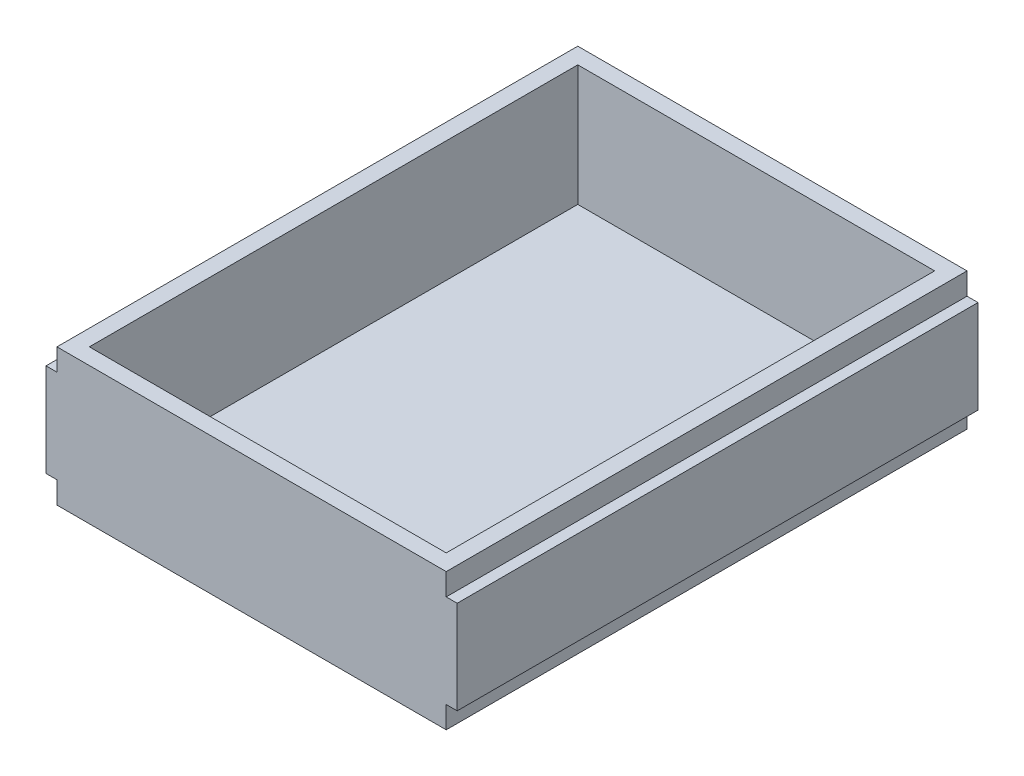
from build123d import *

# Parameters (mm, degrees)
CROQUIS1_W              = 72.136
CROQUIS1_H              = 25.4
SALIENTE_EXTRUIR1_DEPTH = 96.52
VACIADO1_T              = -3
CROQUIS2_W              = 2.032
CROQUIS2_H              = 17.272
SALIENTE_EXTRUIR3_DEPTH = 96.52
CROQUIS4_W              = 16.5
CROQUIS4_H              = 4
SALIENTE_EXTRUIR4_DEPTH = 4.5


with BuildPart() as part:
    # Croquis1 → Saliente-Extruir1 (new body)
    with BuildSketch(Plane.XY):
        with Locations((-36.068, 12.7)):
            Rectangle(CROQUIS1_W, CROQUIS1_H)
    extrude(amount=SALIENTE_EXTRUIR1_DEPTH)

    # Vaciado1
    vaciado1_openings = [part.faces().sort_by_distance(p)[0] for p in [
        (-36.068, 25.4, 48.26),
    ]]
    offset(amount=VACIADO1_T, openings=vaciado1_openings, kind=Kind.INTERSECTION)

    # Croquis2 → Saliente-Extruir3 (add)
    with BuildSketch(Plane(origin=(0, 0, 0), x_dir=(-1, 0, 0), z_dir=(0, 0, -1))):
        with Locations((-1.016, 12.7)):
            Rectangle(CROQUIS2_W, CROQUIS2_H)
        with Locations((73.152, 12.7)):
            Rectangle(CROQUIS2_W, CROQUIS2_H)
    extrude(amount=-SALIENTE_EXTRUIR3_DEPTH)

    # Croquis4 → Saliente-Extruir4 (add)
    with BuildSketch(Plane(origin=(0, 0, 0), x_dir=(-1, 0, 0), z_dir=(0, 0, -1))):
        with Locations((36.068, 3.262624702)):
            Rectangle(CROQUIS4_W, CROQUIS4_H)
    extrude(amount=SALIENTE_EXTRUIR4_DEPTH)


solid = part.part
